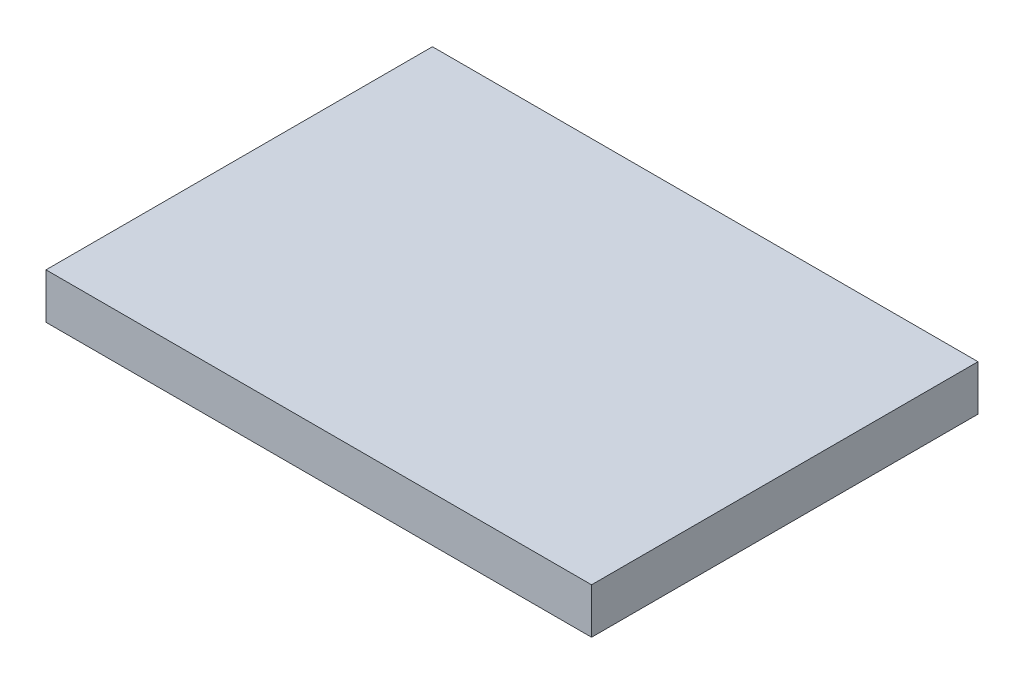
from build123d import *

# Parameters (mm, degrees)
SKETCH1_W           = 30.48
SKETCH1_H           = 21.59
BOSS_EXTRUDE1_DEPTH = 2.54


with BuildPart() as part:
    # Sketch1 → Boss-Extrude1 (new body)
    with BuildSketch(Plane(origin=(0, 0, 0), x_dir=(1, 0, 0), z_dir=(0, 1, 0))):
        with Locations((15.24, 10.795)):
            Rectangle(SKETCH1_W, SKETCH1_H)
    extrude(amount=BOSS_EXTRUDE1_DEPTH)


solid = part.part
